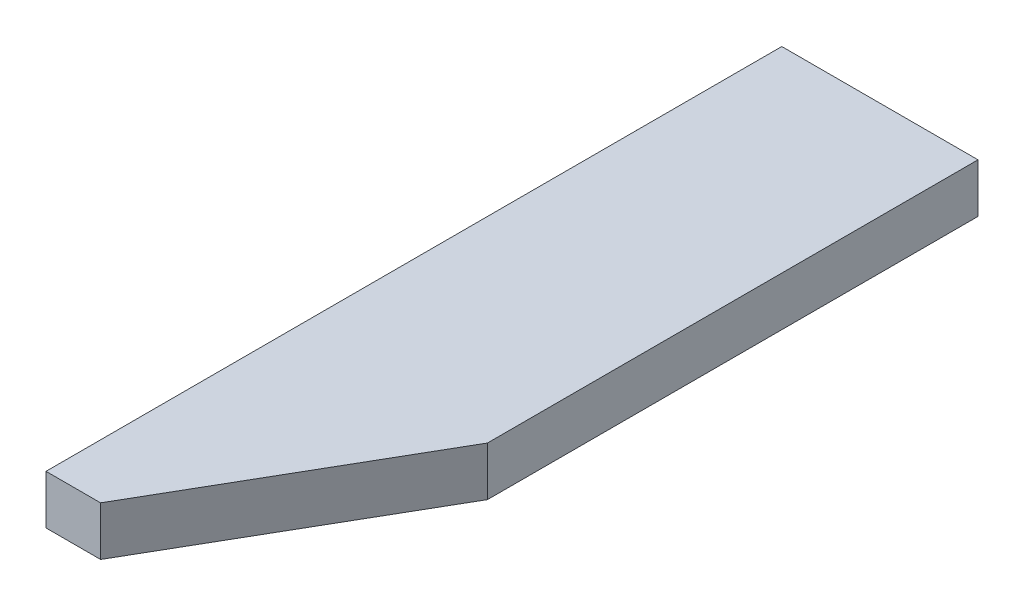
from build123d import *

# Parameters (mm, degrees)
SKICA1_W                 = 40
SKICA1_H                 = 10
P_IDAT_VYSUNUT_M1_DEPTH  = 150
ODEBRAT_VYSUNUT_M1_DEPTH = 156.563491861


with BuildPart() as part:
    # Skica1 → Přidat vysunutím1 (new body)
    with BuildSketch(Plane.XY):
        with Locations((20, 5)):
            Rectangle(SKICA1_W, SKICA1_H)
    extrude(amount=P_IDAT_VYSUNUT_M1_DEPTH)

    # Skica5 → Odebrat vysunutím1 (cut, through all)
    with BuildSketch(Plane(origin=(0, 10, 0), x_dir=(1, 0, 0), z_dir=(0, 1, 0))):
        Polygon((40, -150), (40, -100), (11.132486541, -150), align=None)
    extrude(amount=-ODEBRAT_VYSUNUT_M1_DEPTH, mode=Mode.SUBTRACT)


solid = part.part
